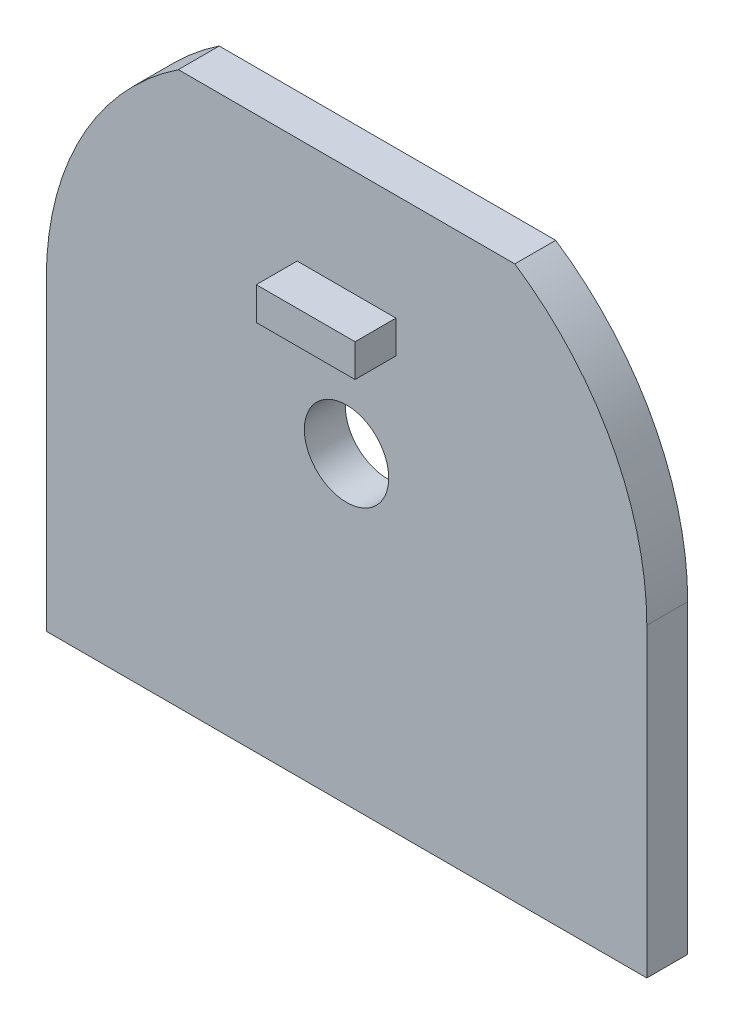
from build123d import *

# Parameters (mm, degrees)
SKETCH1_R           = 0.815
BOSS_EXTRUDE1_DEPTH = 0.79
SKETCH2_W           = 1.90810027
SKETCH2_H           = 0.63280283
BOSS_EXTRUDE2_DEPTH = 0.79


with BuildPart() as part:
    # Sketch1 → Boss-Extrude1 (new body)
    with BuildSketch(Plane.XY):
        with BuildLine():
            Line((-5.8, 0.599999942), (-5.8, -5.299999942))
            Line((-5.8, -5.299999942), (5.8, -5.299999942))
            Line((5.8, -5.299999942), (5.8, 0.599999942))
            ThreePointArc((5.8, 0.599999942), (5.12250756, 3.304927434), (3.249999977, 5.371166553))
            Line((3.249999977, 5.371166553), (-3.249999977, 5.371166553))
            ThreePointArc((-3.249999977, 5.371166553), (-5.12250756, 3.304927434), (-5.8, 0.599999942))
        make_face()
        with Locations(Location((0, 0.571166501, 0), (0, 0, 180))):
            Circle(SKETCH1_R, mode=Mode.SUBTRACT)
    extrude(amount=BOSS_EXTRUDE1_DEPTH)

    # Sketch2 → Boss-Extrude2 (add)
    with BuildSketch(Plane.XY.offset(0.79)):
        with Locations((0, 3)):
            Rectangle(SKETCH2_W, SKETCH2_H)
    extrude(amount=BOSS_EXTRUDE2_DEPTH)


solid = part.part
